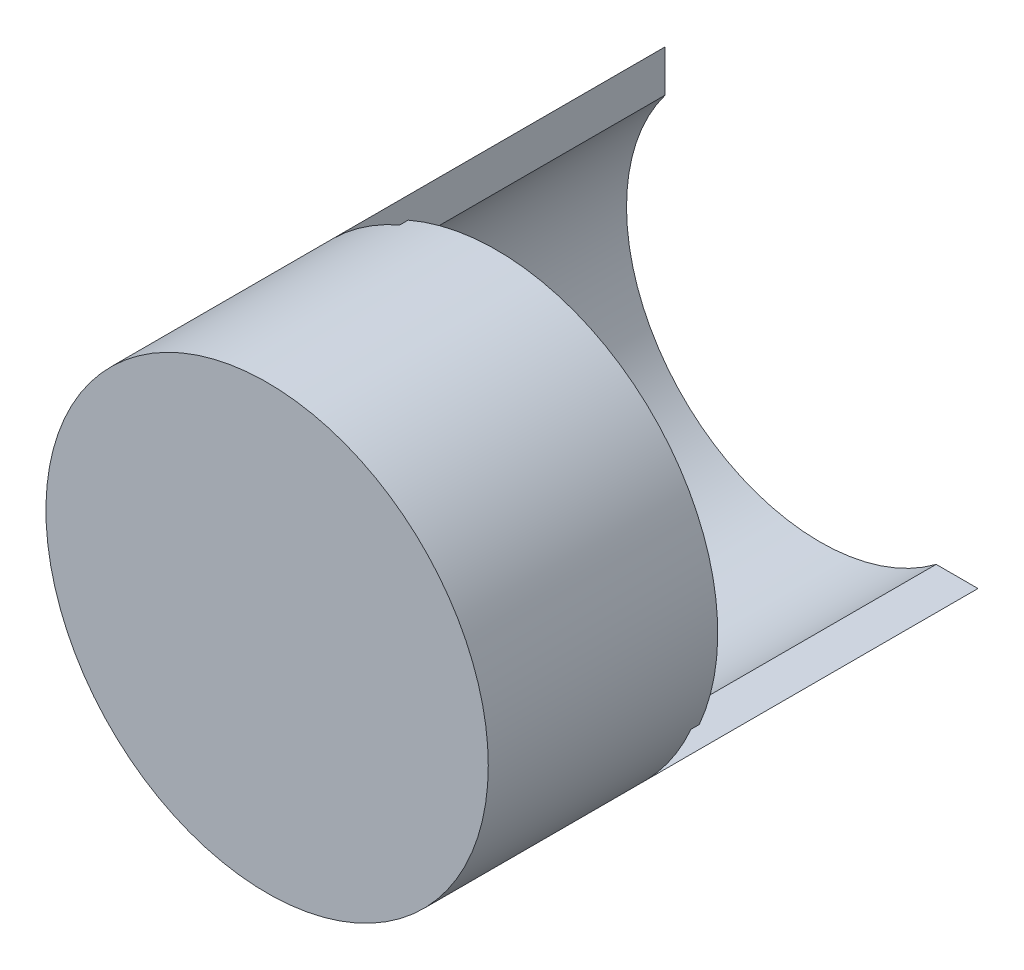
from build123d import *
from build123d.topology import SkipClean

# Parameters (mm, degrees)
SKETCH1_R           = 50.8
BOSS_EXTRUDE1_DEPTH = 50.8
SKETCH2_R           = 44.45
CUT_EXTRUDE1_DEPTH  = 44.45
BOSS_EXTRUDE2_START = 76.2
BOSS_EXTRUDE2_DEPTH = 76.2
BOSS_EXTRUDE3_START = 1.905
BOSS_EXTRUDE3_DEPTH = 1.905


with BuildPart() as part:
    # Sketch1 → Boss-Extrude1 (new body)
    with BuildSketch(Plane.XY):
        Circle(SKETCH1_R)
    extrude(amount=BOSS_EXTRUDE1_DEPTH)

    # Sketch2 → Cut-Extrude1 (cut)
    with BuildSketch(Plane(origin=(0, 0, 0), x_dir=(-1, 0, 0), z_dir=(0, 0, -1))):
        Circle(SKETCH2_R)
    extrude(amount=-CUT_EXTRUDE1_DEPTH, mode=Mode.SUBTRACT)

    # Sketch3 → Boss-Extrude2 (add)
    with BuildSketch(Plane(origin=(0, 0, 0), x_dir=(-1, 0, 0), z_dir=(0, 0, -1)).offset(BOSS_EXTRUDE2_START)):
        with BuildLine():
            Line((-36.278456417, -35.56), (-26.67, -35.56))
            ThreePointArc((-26.67, -35.56), (31.430896424, -31.430896424), (35.56, 26.67))
            Line((35.56, 26.67), (35.56, 36.278456417))
            ThreePointArc((35.56, 36.278456417), (35.921024484, -35.921024484), (-36.278456417, -35.56))
        make_face()
    extrude(amount=-BOSS_EXTRUDE2_DEPTH)

    # Sketch4 → Boss-Extrude3 (add)
    with SkipClean():  # the faces are left unmerged after this step: merging them gives an invalid solid
        with BuildSketch(Plane(origin=(0, 0, 0), x_dir=(-1, 0, 0), z_dir=(0, 0, -1)).offset(BOSS_EXTRUDE3_START)):
            with BuildLine():
                Line((-46.558969061, -20.32), (-39.533531337, -20.32))
                ThreePointArc((-39.533531337, -20.32), (-31.430896424, 31.430896424), (20.32, 39.533531337))
                Line((20.32, 39.533531337), (20.32, 46.558969061))
                ThreePointArc((20.32, 46.558969061), (-35.921024484, 35.921024484), (-46.558969061, -20.32))
            make_face()
        extrude(amount=-BOSS_EXTRUDE3_DEPTH)


solid = part.part
